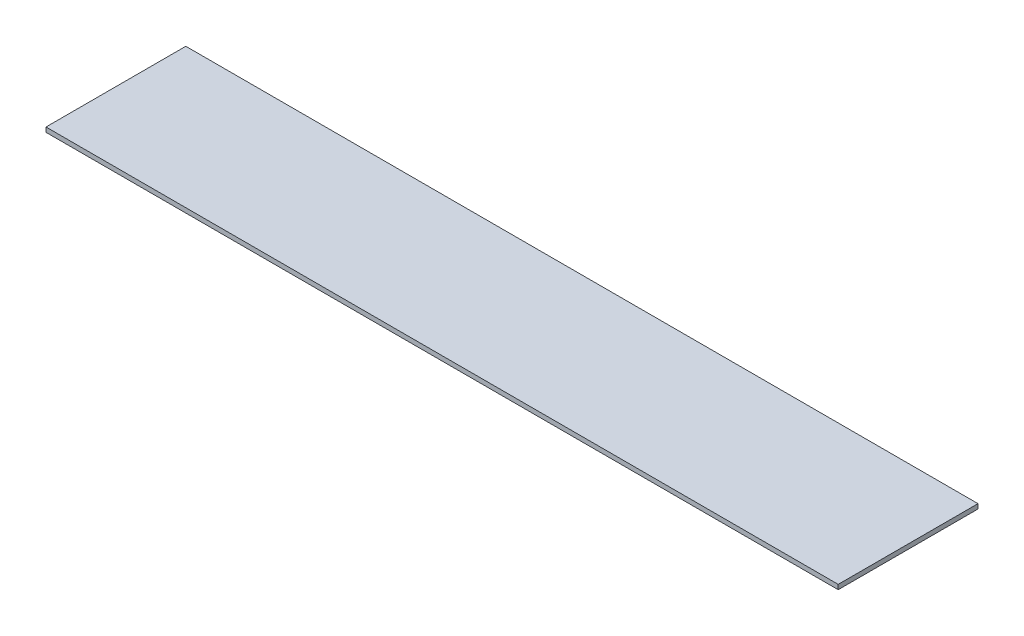
from build123d import *

# Parameters (mm, degrees)
SKETCH1_W           = 170
SKETCH1_H           = 30
BOSS_EXTRUDE1_DEPTH = 1


with BuildPart() as part:
    # Sketch1 → Boss-Extrude1 (new body)
    with BuildSketch(Plane(origin=(0, 0, 0), x_dir=(1, 0, 0), z_dir=(0, 1, 0))):
        with Locations((35.06993007, 50.582750583)):
            Rectangle(SKETCH1_W, SKETCH1_H)
    extrude(amount=BOSS_EXTRUDE1_DEPTH)


solid = part.part
